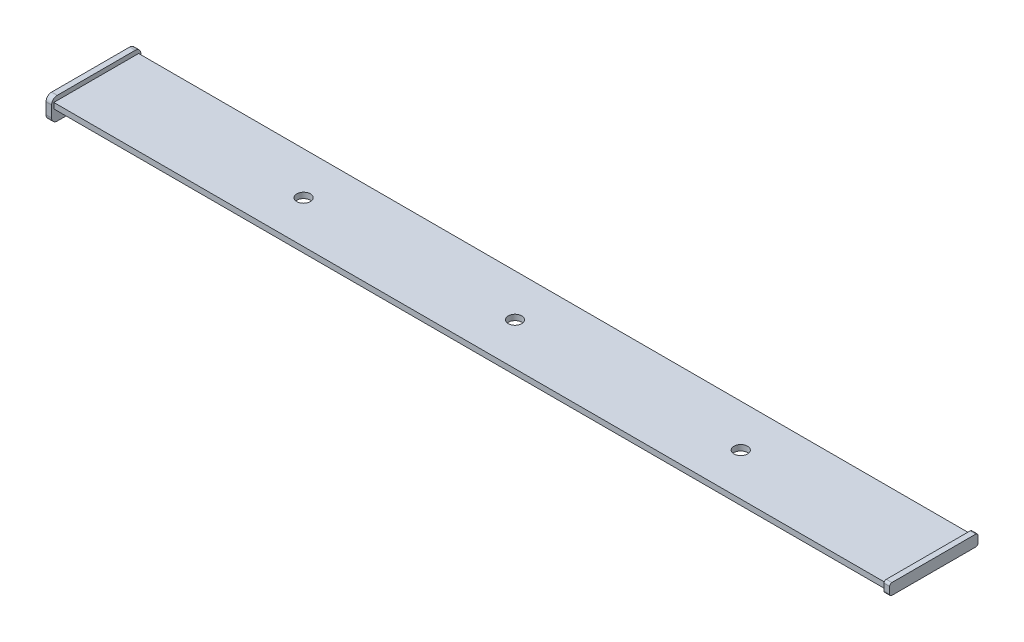
from build123d import *

# Parameters (mm, degrees)
SKETCH1_W           = 3750
SKETCH1_H           = 379.6875
BOSS_EXTRUDE1_DEPTH = 25
SKETCH2_W           = 3806.146238169
SKETCH2_H           = 15
CUT_EXTRUDE1_DEPTH  = 15
SKETCH3_R           = 30.381139082
CUT_EXTRUDE2_DEPTH  = 1885.752145353
BOSS_EXTRUDE2_DEPTH = 25
BOSS_EXTRUDE3_DEPTH = 25


with BuildPart() as part:
    # Sketch1 → Boss-Extrude1 (new body)
    with BuildSketch(Plane(origin=(0, 0, 0), x_dir=(1, 0, 0), z_dir=(0, 1, 0))):
        Rectangle(SKETCH1_W, SKETCH1_H)
    extrude(amount=BOSS_EXTRUDE1_DEPTH)

    # Sketch2 → Cut-Extrude1 (cut)
    with BuildSketch(Plane.XZ):
        with Locations((28.073119084, 150.111800851)):
            Rectangle(SKETCH2_W, SKETCH2_H)
        with Locations((28.073119084, -150.111800851)):
            Rectangle(SKETCH2_W, SKETCH2_H)
    extrude(amount=-CUT_EXTRUDE1_DEPTH, mode=Mode.SUBTRACT)

    # Sketch3 → Cut-Extrude2 (cut, through all)
    with BuildSketch(Plane.XZ):
        with Locations(Location((0, 0, 0), (0, 0, 270))):
            Circle(SKETCH3_R)
        with Locations(Location((-946.305515807, 0, 0), (0, 0, 270))):
            Circle(SKETCH3_R)
        with Locations(Location((1010.603651897, 0, 0), (0, 0, 270))):
            Circle(SKETCH3_R)
    extrude(amount=-CUT_EXTRUDE2_DEPTH, mode=Mode.SUBTRACT)

    # Sketch4 → Boss-Extrude2 (add)
    with BuildSketch(Plane(origin=(1875, 0, 0), x_dir=(0, 0, -1), z_dir=(1, 0, 0))):
        with BuildLine():
            Line((-187.814440115, -12.5), (187.814440115, -12.5))
            ThreePointArc((187.814440115, -12.5), (194.885507927, -9.571067812), (197.814440115, -2.5))
            Line((197.814440115, -2.5), (197.814440115, 27.5))
            ThreePointArc((197.814440115, 27.5), (194.885507927, 34.571067812), (187.814440115, 37.5))
            Line((187.814440115, 37.5), (-187.814440115, 37.5))
            ThreePointArc((-187.814440115, 37.5), (-194.885507927, 34.571067812), (-197.814440115, 27.5))
            Line((-197.814440115, 27.5), (-197.814440115, -2.5))
            ThreePointArc((-197.814440115, -2.5), (-194.885507927, -9.571067812), (-187.814440115, -12.5))
        make_face()
    extrude(amount=-BOSS_EXTRUDE2_DEPTH)

    # Sketch5 → Boss-Extrude3 (add)
    with BuildSketch(Plane.ZY.offset(1875)):
        with BuildLine():
            Line((-174.84375, 45), (174.84375, 45))
            ThreePointArc((174.84375, 45), (192.52141953, 37.67766953), (199.84375, 20))
            Line((199.84375, 20), (199.84375, -30))
            ThreePointArc((199.84375, -30), (192.52141953, -47.67766953), (174.84375, -55))
            Line((174.84375, -55), (-174.84375, -55))
            ThreePointArc((-174.84375, -55), (-192.52141953, -47.67766953), (-199.84375, -30))
            Line((-199.84375, -30), (-199.84375, 20))
            ThreePointArc((-199.84375, 20), (-192.52141953, 37.67766953), (-174.84375, 45))
        make_face()
    extrude(amount=BOSS_EXTRUDE3_DEPTH)


solid = part.part
